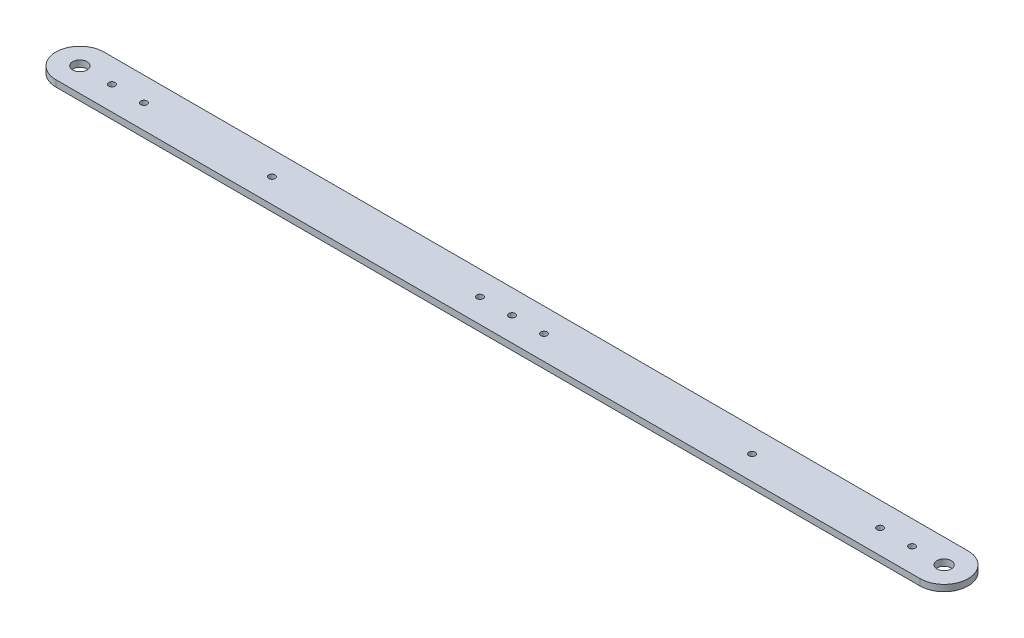
from build123d import *

# Parameters (mm, degrees)
SKETCH1_R           = 4.5
SKETCH1_R_2         = 2
BOSS_EXTRUDE1_DEPTH = 4


with BuildPart() as part:
    # Sketch1 → Boss-Extrude1 (new body)
    with BuildSketch(Plane(origin=(0, 0, 0), x_dir=(1, 0, 0), z_dir=(0, 1, 0))):
        with BuildLine():
            Line((-270, 15), (270, 15))
            ThreePointArc((270, 15), (285, 0), (270, -15))
            Line((270, -15), (-270, -15))
            ThreePointArc((-270, -15), (-285, 0), (-270, 15))
        make_face()
        with Locations(Location((-270, 0, 0), (0, 0, 270))):
            Circle(SKETCH1_R, mode=Mode.SUBTRACT)
        with Locations(Location((270, 0, 0), (0, 0, 270))):
            Circle(SKETCH1_R, mode=Mode.SUBTRACT)
        with Locations(Location((-150, 0, 0), (0, 0, 270))):
            Circle(SKETCH1_R_2, mode=Mode.SUBTRACT)
        with Locations(Location((150, 0, 0), (0, 0, 270))):
            Circle(SKETCH1_R_2, mode=Mode.SUBTRACT)
        with Locations(Location((0, 0, 0), (0, 0, 270))):
            Circle(SKETCH1_R_2, mode=Mode.SUBTRACT)
        with Locations(Location((-250, 0, 0), (0, 0, 270))):
            Circle(SKETCH1_R_2, mode=Mode.SUBTRACT)
        with Locations(Location((-230, 0, 0), (0, 0, 270))):
            Circle(SKETCH1_R_2, mode=Mode.SUBTRACT)
        with Locations(Location((-20, 0, 0), (0, 0, 270))):
            Circle(SKETCH1_R_2, mode=Mode.SUBTRACT)
        with Locations(Location((230, 0, 0), (0, 0, 90))):
            Circle(SKETCH1_R_2, mode=Mode.SUBTRACT)
        with Locations(Location((250, 0, 0), (0, 0, 90))):
            Circle(SKETCH1_R_2, mode=Mode.SUBTRACT)
        with Locations(Location((20, 0, 0), (0, 0, 90))):
            Circle(SKETCH1_R_2, mode=Mode.SUBTRACT)
    extrude(amount=BOSS_EXTRUDE1_DEPTH)


solid = part.part
